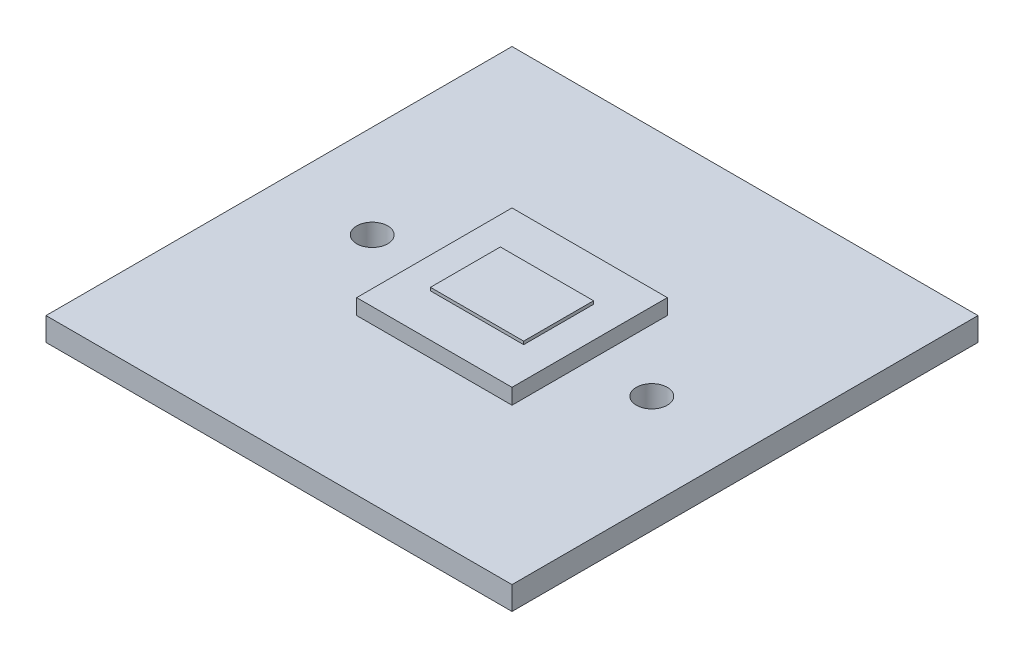
from build123d import *

# Parameters (mm, degrees)
SKETCH_1_W          = 10
SKETCH_1_H          = 10
EXTRUDE_1_DEPTH     = 1
SKETCH_2_W          = 6
SKETCH_2_H          = 4.5
EXTRUDE_2_DEPTH     = 0.2
SKETCH_3_W          = 30
SKETCH_3_H          = 30
EXTRUDE_3_DEPTH     = 1.5
SKETCH_4_R          = 1
CUT_EXTRUDE_2_DEPTH = 22.266170318


with BuildPart() as part:
    # 草图1 → 凸台-拉伸1 (new body)
    with BuildSketch(Plane(origin=(0, 0, 0), x_dir=(1, 0, 0), z_dir=(0, 1, 0))):
        Rectangle(SKETCH_1_W, SKETCH_1_H)
    extrude(amount=EXTRUDE_1_DEPTH)

    # 草图2 → 凸台-拉伸2 (add)
    with BuildSketch(Plane(origin=(0, 1, 0), x_dir=(1, 0, 0), z_dir=(0, 1, 0))):
        Rectangle(SKETCH_2_W, SKETCH_2_H)
    extrude(amount=EXTRUDE_2_DEPTH)

    # 草图3 → 凸台-拉伸3 (add)
    with BuildSketch(Plane.XZ):
        Rectangle(SKETCH_3_W, SKETCH_3_H)
    extrude(amount=EXTRUDE_3_DEPTH)

    # 草图4 → 切除-拉伸2 (cut, through all)
    with BuildSketch(Plane(origin=(0, 0, 0), x_dir=(1, 0, 0), z_dir=(0, 1, 0))):
        with Locations((9, 0)):
            Circle(SKETCH_4_R)
        with Locations((-9, 0)):
            Circle(SKETCH_4_R)
    extrude(amount=-CUT_EXTRUDE_2_DEPTH, mode=Mode.SUBTRACT)


solid = part.part
